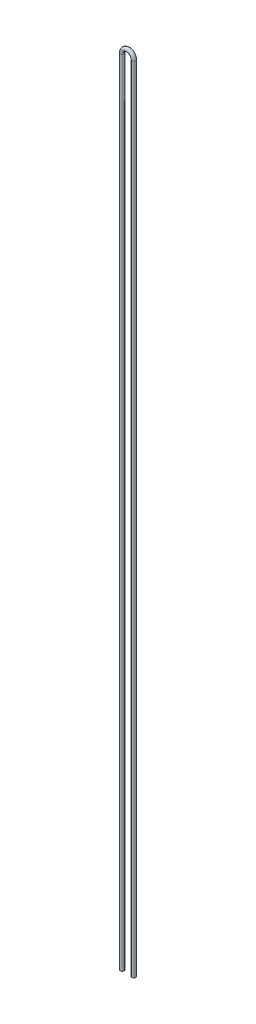
from build123d import *

# Parameters (mm, degrees)
SKETCH1_R = 0.05


with BuildPart() as part:
    # Sweep1: sweep along a path in Sketch2
    with BuildLine(Plane.XY) as sweep1_path:
        Line((-0.15, 0), (-0.15, 20.5))
        ThreePointArc((-0.15, 20.5), (0, 20.65), (0.15, 20.5))
        Line((0.15, 20.5), (0.15, 0))
    # Sketch1 → Sweep1 (sweep)
    with BuildSketch(Plane(origin=(0, 0, 0), x_dir=(1, 0, 0), z_dir=(0, 1, 0))):
        with Locations((0.15, 0)):
            Circle(SKETCH1_R)
    sweep(path=sweep1_path.line)


solid = part.part
